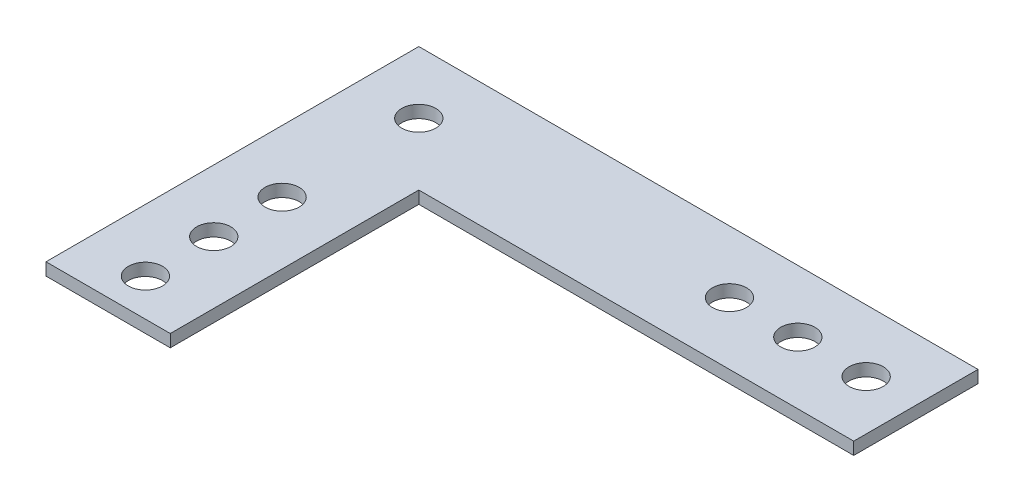
from build123d import *

# Parameters (mm, degrees)
SKETCH_1_R      = 2.75
EXTRUDE_1_DEPTH = 2


with BuildPart() as part:
    # 草图1 → 凸台-拉伸1 (new body)
    with BuildSketch(Plane(origin=(0, 0, 0), x_dir=(1, 0, 0), z_dir=(0, 1, 0))):
        Polygon((0, 0), (90, 0), (90, -20), (20, -20), (20, -60), (0, -60), align=None)
        with Locations(Location((10, -54, 0), (0, 0, 270))):
            Circle(SKETCH_1_R, mode=Mode.SUBTRACT)
        with Locations(Location((82, -10, 0), (0, 0, 270))):
            Circle(SKETCH_1_R, mode=Mode.SUBTRACT)
        with Locations(Location((10, -43, 0), (0, 0, 270))):
            Circle(SKETCH_1_R, mode=Mode.SUBTRACT)
        with Locations(Location((10, -32, 0), (0, 0, 270))):
            Circle(SKETCH_1_R, mode=Mode.SUBTRACT)
        with Locations(Location((71, -10, 0), (0, 0, 270))):
            Circle(SKETCH_1_R, mode=Mode.SUBTRACT)
        with Locations(Location((60, -10, 0), (0, 0, 270))):
            Circle(SKETCH_1_R, mode=Mode.SUBTRACT)
        with Locations(Location((10, -10, 0), (0, 0, 270))):
            Circle(SKETCH_1_R, mode=Mode.SUBTRACT)
    extrude(amount=EXTRUDE_1_DEPTH)


solid = part.part
